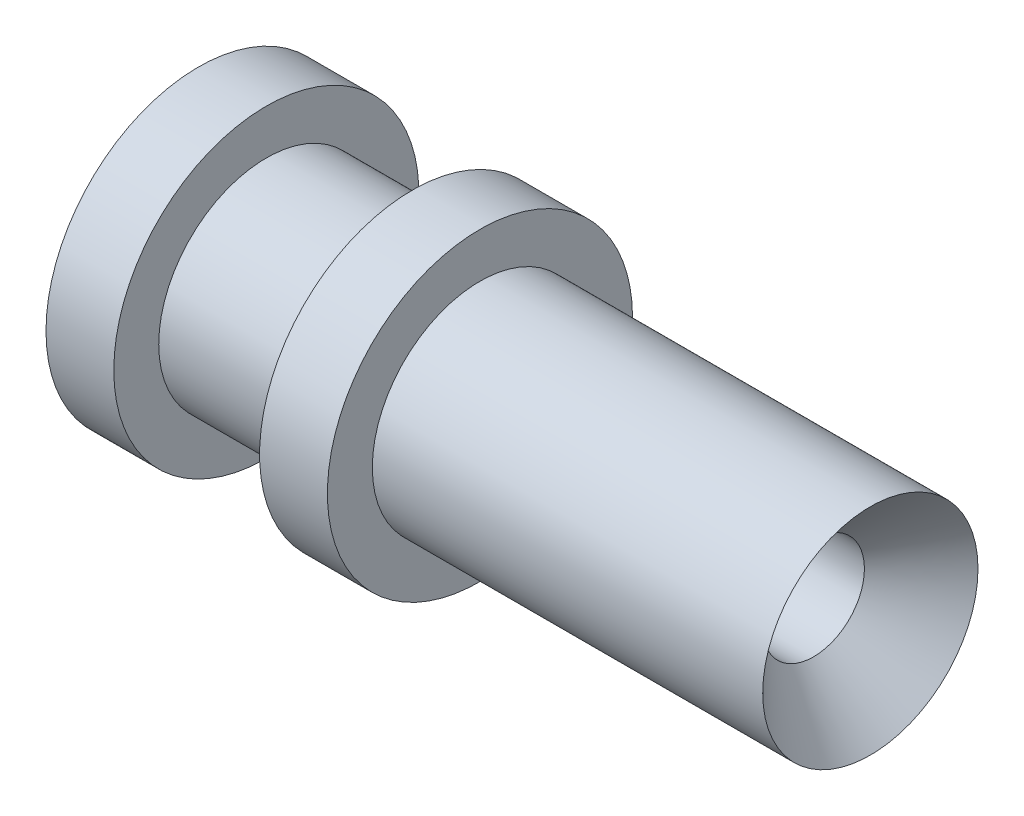
from build123d import *

# Parameters (mm, degrees)
SKETCH1_R                     = 3.175
BOSS_EXTRUDE1_DEPTH           = 18
SKETCH4_R                     = 4.5
BOSS_EXTRUDE2_DEPTH           = 2
BOSS_EXTRUDE3_START           = -6.3
SKETCH4_3_R                   = 4.5
BOSS_EXTRUDE3_DEPTH           = 2
CUT_EXTRUDE3_DEPTH            = 21.988091862
CUT_EXTRUDE3_DEPTH_BACK       = 21.988091862
SKETCH5_R                     = 1.5
CUT_EXTRUDE4_DEPTH            = 21.988091862
CUT_EXTRUDE4_DEPTH_BACK       = 1
CSK_FOR_M3_SFHCS1_D           = 3
CSK_FOR_M3_SFHCS1_DEPTH       = 5.098709071
CSK_FOR_M3_SFHCS1_CSINK_D     = 6.72
CSK_FOR_M3_SFHCS1_CSINK_ANGLE = 90
CSK_FOR_M3_SFHCS1_TIP         = 0.901290929


with BuildPart() as part:
    # Sketch1 → Boss-Extrude1 (new body)
    with BuildSketch(Plane(origin=(0, 0, 0), x_dir=(0, 0, -1), z_dir=(1, 0, 0))):
        Circle(SKETCH1_R)
    extrude(amount=BOSS_EXTRUDE1_DEPTH)

    # Sketch4 → Boss-Extrude2 (add)
    with BuildSketch(Plane.ZY):
        Circle(SKETCH4_R)
    extrude(amount=BOSS_EXTRUDE2_DEPTH)

    # Sketch4<3> → Boss-Extrude3 (add)
    with BuildSketch(Plane.ZY.offset(BOSS_EXTRUDE3_START)):
        Circle(SKETCH4_3_R)
    extrude(amount=BOSS_EXTRUDE3_DEPTH)

    # Sketch5 → Cut-Extrude3 (cut, two sides: drawn at the far end of the back side and taken through both)
    with BuildSketch(Plane.ZY.offset(2).offset(-CUT_EXTRUDE3_DEPTH_BACK)):
        Circle(SKETCH5_R)
    extrude(amount=CUT_EXTRUDE3_DEPTH + CUT_EXTRUDE3_DEPTH_BACK, mode=Mode.SUBTRACT)

    # Sketch6 → Cut-Extrude4 (cut, two sides: drawn at the far end of the back side and taken through both)
    with BuildSketch(Plane.ZY.offset(2).offset(-CUT_EXTRUDE4_DEPTH_BACK)):
        Polygon((2.8, -1.616580754), (2.8, 1.616580754), (0, 3.233161507), (-2.8, 1.616580754), (-2.8, -1.616580754), (0, -3.233161507), align=None)
    extrude(amount=CUT_EXTRUDE4_DEPTH + CUT_EXTRUDE4_DEPTH_BACK, mode=Mode.SUBTRACT)

    # CSK for M3 SFHCS1
    with Locations(Plane(origin=(18, 0, 0), x_dir=(0, 0, -1), z_dir=(1, 0, 0))):
        with Locations((0, 0)):
            CounterSinkHole(CSK_FOR_M3_SFHCS1_D / 2, CSK_FOR_M3_SFHCS1_CSINK_D / 2, depth=CSK_FOR_M3_SFHCS1_DEPTH, counter_sink_angle=CSK_FOR_M3_SFHCS1_CSINK_ANGLE)
            with Locations((0, 0, -(CSK_FOR_M3_SFHCS1_DEPTH + CSK_FOR_M3_SFHCS1_TIP / 2))):  # 118° drill point
                Cone(0, CSK_FOR_M3_SFHCS1_D / 2, CSK_FOR_M3_SFHCS1_TIP, mode=Mode.SUBTRACT)


solid = part.part
